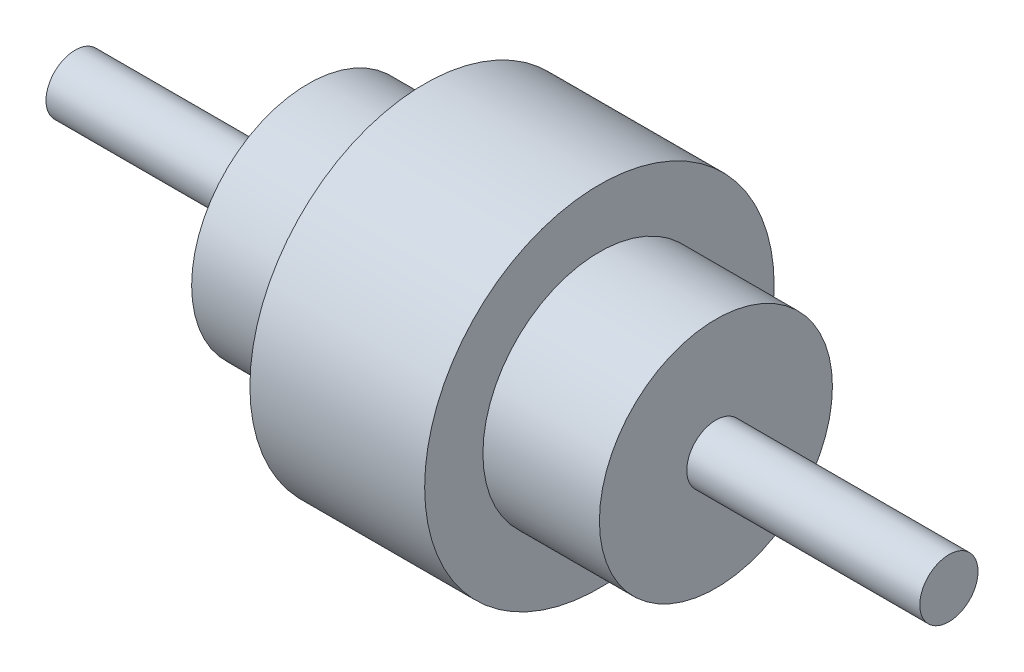
from build123d import *


with BuildPart() as part:
    # Sketch1 → Revolve1 (revolve)
    with BuildSketch(Plane(origin=(0, 0, 0), x_dir=(1, 0, 0), z_dir=(0, 1, 0))):
        Polygon((0, 0), (300, 0), (300, -10), (220, -10), (220, -40), (180, -40), (180, -60), (120, -60), (120, -40), (80, -40), (80, -10), (0, -10), align=None)
    revolve(axis=Axis((0, 0, 0), (1, 0, 0)))


solid = part.part
